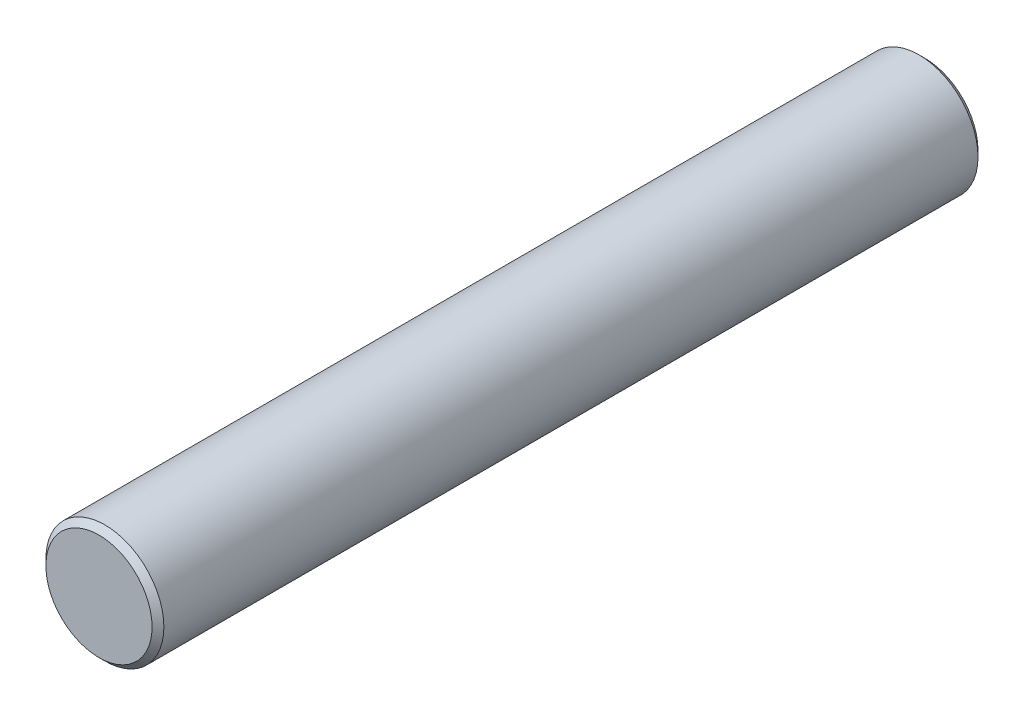
from build123d import *

# Parameters (mm, degrees)
SKETCH1_R           = 2.5
BOSS_EXTRUDE1_DEPTH = 35
CHAMFER1_SIZE       = 0.25


with BuildPart() as part:
    # Sketch1 → Boss-Extrude1 (new body)
    with BuildSketch(Plane.XY):
        Circle(SKETCH1_R)
    extrude(amount=BOSS_EXTRUDE1_DEPTH)

    # Chamfer1
    chamfer1_edges = [part.edges().sort_by_distance(p)[0] for p in [
        (-2.5, 0, 0),
        (-2.5, 0, 35),
    ]]
    chamfer(chamfer1_edges, length=CHAMFER1_SIZE)


solid = part.part
